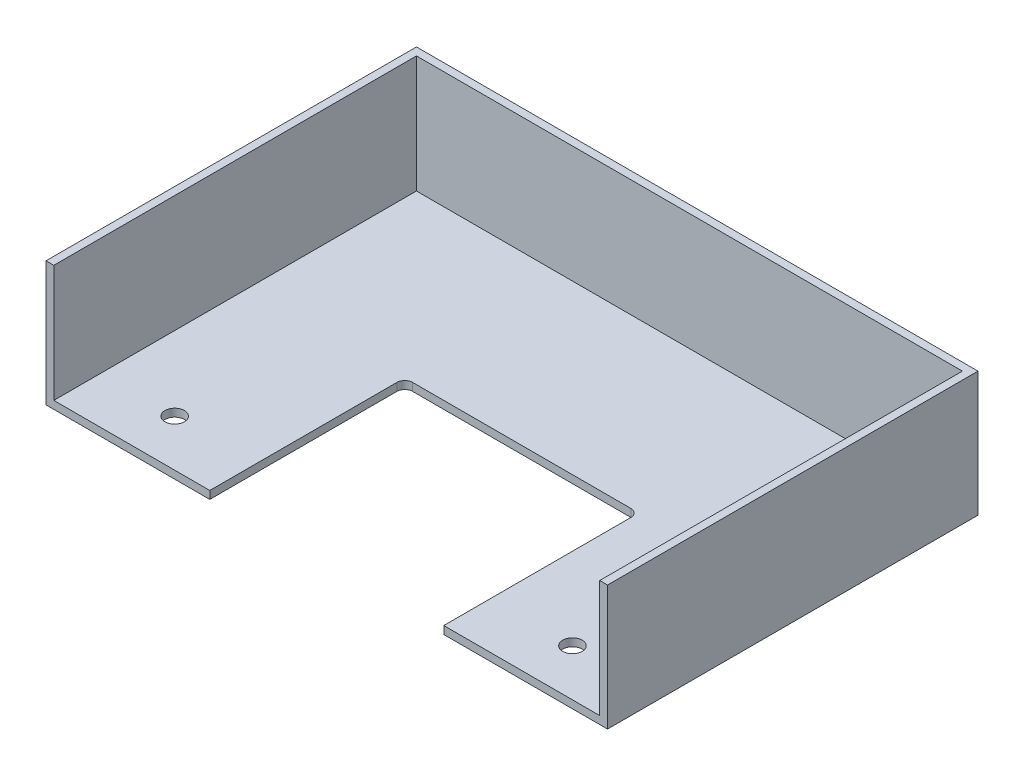
from build123d import *

# Parameters (mm, degrees)
SKETCH_1_W            = 144
SKETCH_1_H            = 95
EXTRUDE_1_DEPTH       = 32
SKETCH_2_W            = 140
SKETCH_2_H            = 93
CUT_EXTRUDE_1_DEPTH   = 30
CUT_EXTRUDE_2_DEPTH   = 93.001358686
HOLE_WIZARD_5_0_5_1_D = 5


with BuildPart() as part:
    # 草图1 → 凸台-拉伸1 (new body)
    with BuildSketch(Plane.XZ):
        Rectangle(SKETCH_1_W, SKETCH_1_H)
    extrude(amount=-EXTRUDE_1_DEPTH)

    # 草图2 → 切除-拉伸1 (cut)
    with BuildSketch(Plane(origin=(0, 32, 0), x_dir=(-1, 0, 0), z_dir=(0, 1, 0))):
        with Locations((0, 1)):
            Rectangle(SKETCH_2_W, SKETCH_2_H)
    extrude(amount=-CUT_EXTRUDE_1_DEPTH, mode=Mode.SUBTRACT)

    # 草图3 → 切除-拉伸2 (cut, through all)
    with BuildSketch(Plane.XZ):
        with BuildLine():
            Line((30, 47.5), (-30, 47.5))
            Line((-30, 47.5), (-30, -0.5))
            ThreePointArc((-30, -0.5), (-29.414213562, -1.914213562), (-28, -2.5))
            Line((-28, -2.5), (28, -2.5))
            ThreePointArc((28, -2.5), (29.414213562, -1.914213562), (30, -0.5))
            Line((30, -0.5), (30, 47.5))
        make_face()
    extrude(amount=-CUT_EXTRUDE_2_DEPTH, mode=Mode.SUBTRACT)

    # Ø5.0 (5) 直径孔1 (through all)
    with Locations(Plane(origin=(0, 2, 0), x_dir=(1, 0, 0), z_dir=(0, 1, 0))):
        with Locations((51, -35.5), (-51, -35.5)):
            Hole(HOLE_WIZARD_5_0_5_1_D / 2)


solid = part.part
